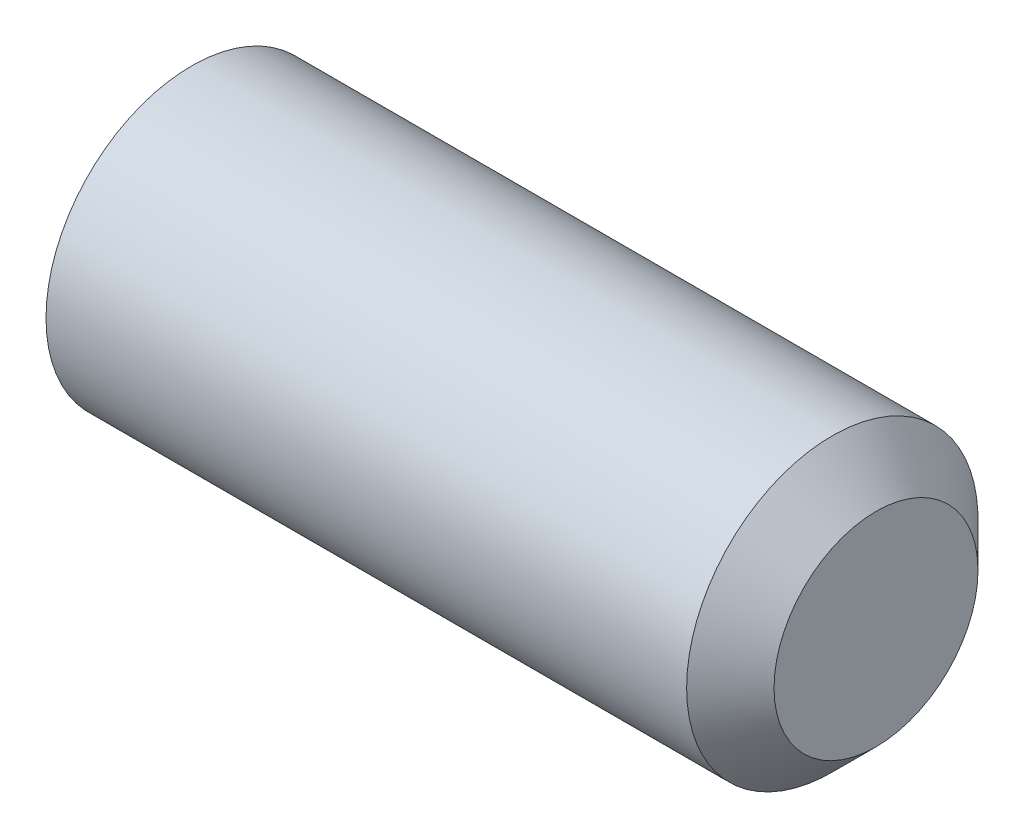
from build123d import *

# Parameters (mm, degrees)
HEX_2_DEPTH = 3


with BuildPart() as part:
    # BodySke → BaseBody (revolve)
    with BuildSketch(Plane.XY, mode=Mode.PRIVATE) as basebody_sk:
        Polygon((0, 0), (0, 2.055), (0.25692087, 2.5), (11.25, 2.5), (12, 1.75), (12, 0), align=None)
    revolve(basebody_sk.sketch.rotate(Axis((-12.7, 0, 0), (1, 0, 0)), 90), axis=Axis((-12.7, 0, 0), (1, 0, 0)))

    # Sketch2 → Hex 2 (cut)
    with BuildSketch(Plane.ZY):
        Polygon((0.721687836, 1.25), (-0.721687836, 1.25), (-1.443375673, 0), (-0.721687836, -1.25), (0.721687836, -1.25), (1.443375673, 0), align=None)
    extrude(amount=-HEX_2_DEPTH, mode=Mode.SUBTRACT)


solid = part.part
